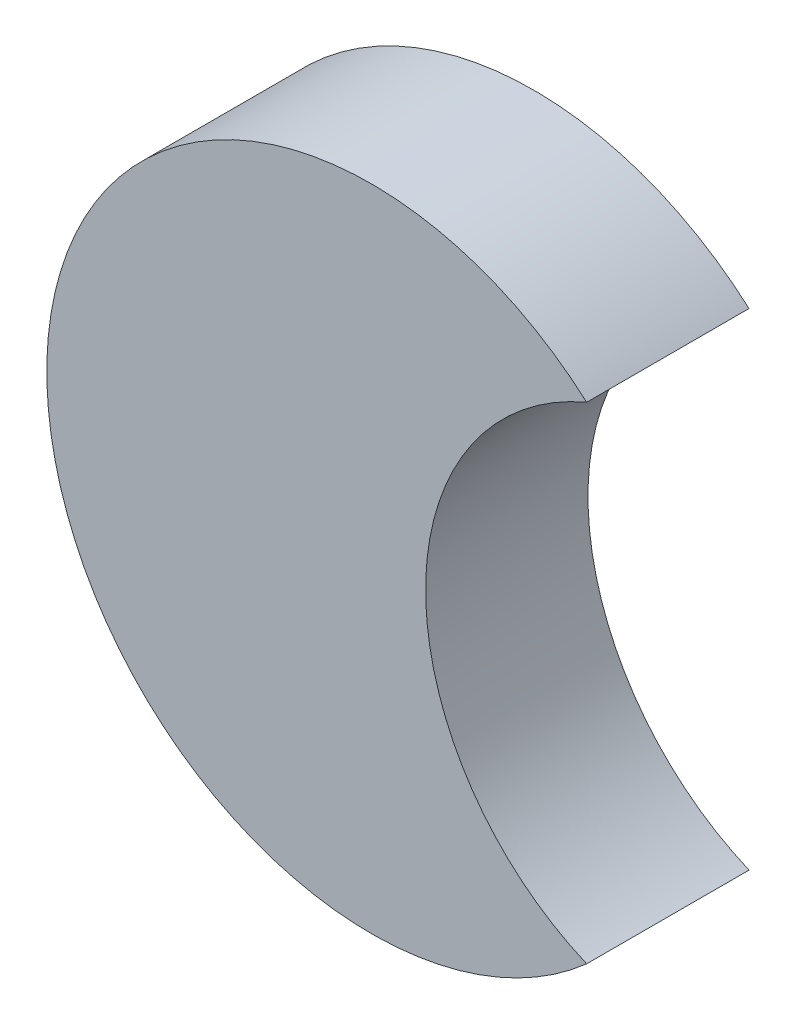
from build123d import *

# Parameters (mm, degrees)
SKETCH1_R           = 60
BOSS_EXTRUDE1_DEPTH = 30
SKETCH2_R           = 48.8
CUT_EXTRUDE1_DEPTH  = 30


with BuildPart() as part:
    # Sketch1 → Boss-Extrude1 (new body)
    with BuildSketch(Plane.XY):
        Circle(SKETCH1_R)
    extrude(amount=BOSS_EXTRUDE1_DEPTH)

    # Sketch2 → Cut-Extrude1 (cut)
    with BuildSketch(Plane.XY.offset(30)):
        with Locations((58.8, 0)):
            Circle(SKETCH2_R)
    extrude(amount=-CUT_EXTRUDE1_DEPTH, mode=Mode.SUBTRACT)


solid = part.part
